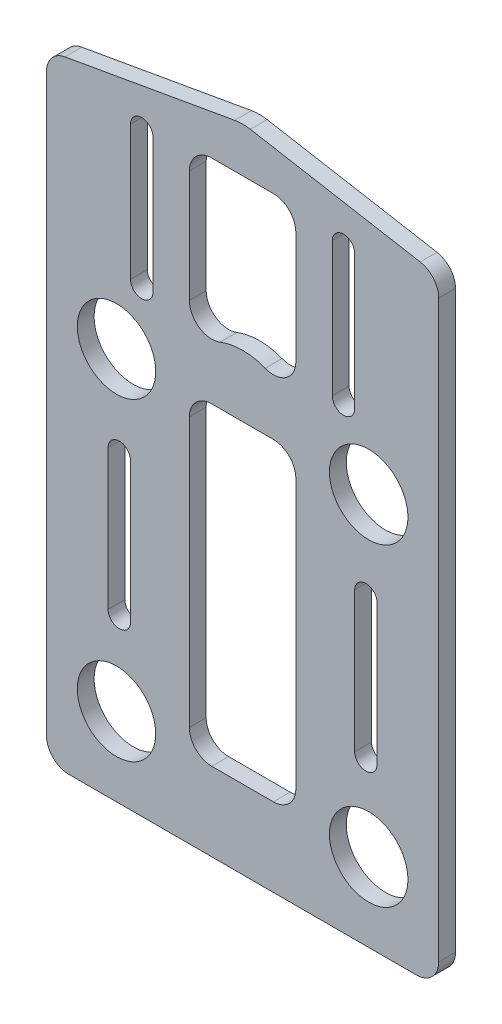
from build123d import *

# Parameters (mm, degrees)
SKETCH1_R          = 3.5
CAMERA_PLATE_DEPTH = 1.5


with BuildPart() as part:
    # Sketch1 → camera-plate (new body)
    with BuildSketch(Plane.XY):
        with BuildLine():
            Line((-0.694592711, 30.451238869), (-15.847296355, 27.779408386))
            ThreePointArc((-15.847296355, 27.779408386), (-17.032088886, 27.0953681), (-17.5, 25.80979288))
            Line((-17.5, 25.80979288), (-17.5, -25.487992143))
            ThreePointArc((-17.5, -25.487992143), (-16.914213562, -26.902205705), (-15.5, -27.487992143))
            Line((-15.5, -27.487992143), (15.5, -27.487992143))
            ThreePointArc((15.5, -27.487992143), (16.914213562, -26.902205705), (17.5, -25.487992143))
            Line((17.5, -25.487992143), (17.5, 25.80979288))
            ThreePointArc((17.5, 25.80979288), (17.032088886, 27.0953681), (15.847296355, 27.779408386))
            Line((15.847296355, 27.779408386), (0.694592711, 30.451238869))
            ThreePointArc((0.694592711, 30.451238869), (0, 30.512007857), (-0.694592711, 30.451238869))
        make_face()
        with Locations(Location((-11.25, 7.512007857, 0), (0, 0, 180))):
            Circle(SKETCH1_R, mode=Mode.SUBTRACT)
        with Locations(Location((-11.25, -20.487992143, 0), (0, 0, 180))):
            Circle(SKETCH1_R, mode=Mode.SUBTRACT)
        with Locations(Location((11.25, -20.487992143, 0), (0, 0, 180))):
            Circle(SKETCH1_R, mode=Mode.SUBTRACT)
        with Locations(Location((11.25, 7.512007857, 0), (0, 0, 180))):
            Circle(SKETCH1_R, mode=Mode.SUBTRACT)
        with BuildLine():
            Line((4.75, 24.512007857), (4.75, 14.512007857))
            ThreePointArc((4.75, 14.512007857), (3.875930191, 12.859046513), (2.017718795, 12.650888776))
            ThreePointArc((2.017718795, 12.650888776), (0, 13.033559582), (-2.017718795, 12.650888776))
            ThreePointArc((-2.017718795, 12.650888776), (-3.875930191, 12.859046513), (-4.75, 14.512007857))
            Line((-4.75, 14.512007857), (-4.75, 24.512007857))
            ThreePointArc((-4.75, 24.512007857), (-4.164213562, 25.92622142), (-2.75, 26.512007857))
            Line((-2.75, 26.512007857), (2.75, 26.512007857))
            ThreePointArc((2.75, 26.512007857), (4.164213562, 25.92622142), (4.75, 24.512007857))
        make_face(mode=Mode.SUBTRACT)
        with BuildLine():
            Line((2.75, -20.487992143), (-2.75, -20.487992143))
            ThreePointArc((-2.75, -20.487992143), (-4.164213562, -19.902205705), (-4.75, -18.487992143))
            Line((-4.75, -18.487992143), (-4.75, 5.512007857))
            ThreePointArc((-4.75, 5.512007857), (-4.164213562, 6.92622142), (-2.75, 7.512007857))
            Line((-2.75, 7.512007857), (2.75, 7.512007857))
            ThreePointArc((2.75, 7.512007857), (4.164213562, 6.92622142), (4.75, 5.512007857))
            Line((4.75, 5.512007857), (4.75, -18.487992143))
            ThreePointArc((4.75, -18.487992143), (4.164213562, -19.902205705), (2.75, -20.487992143))
        make_face(mode=Mode.SUBTRACT)
        with BuildLine():
            Line((-12, -12.987992143), (-12, -0.487992143))
            ThreePointArc((-12, -0.487992143), (-11, 0.512007857), (-10, -0.487992143))
            Line((-10, -0.487992143), (-10, -12.987992143))
            ThreePointArc((-10, -12.987992143), (-11, -13.987992143), (-12, -12.987992143))
        make_face(mode=Mode.SUBTRACT)
        with BuildLine():
            Line((-10, 13.512007857), (-10, 25.512007857))
            ThreePointArc((-10, 25.512007857), (-9, 26.512007857), (-8, 25.512007857))
            Line((-8, 25.512007857), (-8, 13.512007857))
            ThreePointArc((-8, 13.512007857), (-9, 12.512007857), (-10, 13.512007857))
        make_face(mode=Mode.SUBTRACT)
        with BuildLine():
            Line((10, -12.987992143), (10, -0.487992143))
            ThreePointArc((10, -0.487992143), (11, 0.512007857), (12, -0.487992143))
            Line((12, -0.487992143), (12, -12.987992143))
            ThreePointArc((12, -12.987992143), (11, -13.987992143), (10, -12.987992143))
        make_face(mode=Mode.SUBTRACT)
        with BuildLine():
            Line((8, 13.512007857), (8, 25.512007857))
            ThreePointArc((8, 25.512007857), (9, 26.512007857), (10, 25.512007857))
            Line((10, 25.512007857), (10, 13.512007857))
            ThreePointArc((10, 13.512007857), (9, 12.512007857), (8, 13.512007857))
        make_face(mode=Mode.SUBTRACT)
    extrude(amount=-CAMERA_PLATE_DEPTH)


solid = part.part
